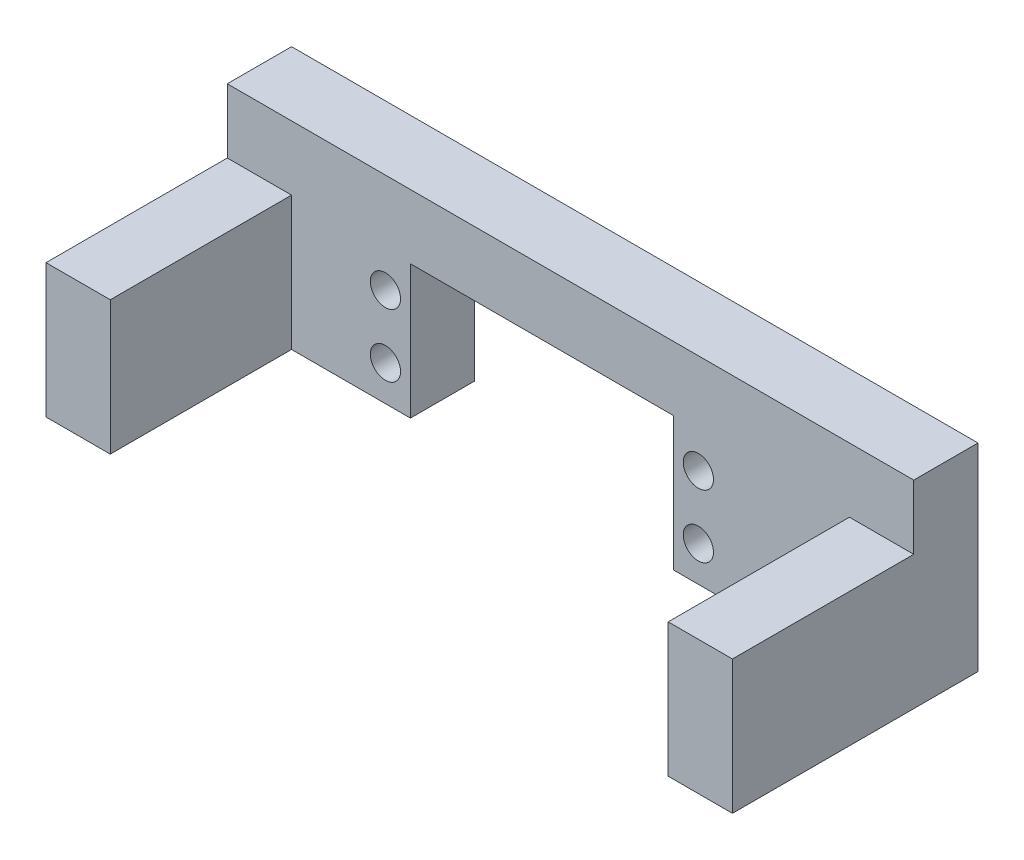
from build123d import *

# Parameters (mm, degrees)
SKETCH1_W           = 18.495
SKETCH1_H           = 20.8
SKETCH1_W_2         = 10
SKETCH1_W_3         = 37.395
BOSS_EXTRUDE1_DEPTH = 10
SKETCH2_W           = 10
SKETCH2_H           = 20.8
BOSS_EXTRUDE2_DEPTH = 28.2
SKETCH6_W           = 106.79
SKETCH6_H           = 10
BOSS_EXTRUDE4_DEPTH = 10
SKETCH9_R           = 2.35
CUT_EXTRUDE1_DEPTH  = 10


with BuildPart() as part:
    # Sketch1 → Boss-Extrude1 (new body)
    with BuildSketch(Plane.XY):
        with Locations((-39.1475, 0)):
            Rectangle(SKETCH1_W, SKETCH1_H)
        with Locations((-53.395, 0)):
            Rectangle(SKETCH1_W_2, SKETCH1_H)
        with Locations((29.6975, 0)):
            Rectangle(SKETCH1_W_3, SKETCH1_H)
    extrude(amount=BOSS_EXTRUDE1_DEPTH)

    # Sketch2 → Boss-Extrude2 (add)
    with BuildSketch(Plane.XY.offset(10)):
        with Locations((43.395, 0)):
            Rectangle(SKETCH2_W, SKETCH2_H)
        with Locations((-53.395, 0)):
            Rectangle(SKETCH2_W, SKETCH2_H)
    extrude(amount=BOSS_EXTRUDE2_DEPTH)

    # Sketch6 → Boss-Extrude4 (add)
    with BuildSketch(Plane(origin=(0, 10.4, 0), x_dir=(1, 0, 0), z_dir=(0, 1, 0))):
        with Locations((-5, -5)):
            Rectangle(SKETCH6_W, SKETCH6_H)
    extrude(amount=BOSS_EXTRUDE4_DEPTH)

    # Sketch9 → Cut-Extrude1 (cut)
    with BuildSketch(Plane.XY.offset(10)):
        with Locations((14.89, -4.9)):
            Circle(SKETCH9_R)
        with Locations(Location((14.89, 4.9, 0), (0, 0, 180))):
            Circle(SKETCH9_R)
        with Locations(Location((-33.79, -4.9, 0), (0, 0, 180))):
            Circle(SKETCH9_R)
        with Locations((-33.79, 4.9)):
            Circle(SKETCH9_R)
    extrude(amount=-CUT_EXTRUDE1_DEPTH, mode=Mode.SUBTRACT)


solid = part.part
